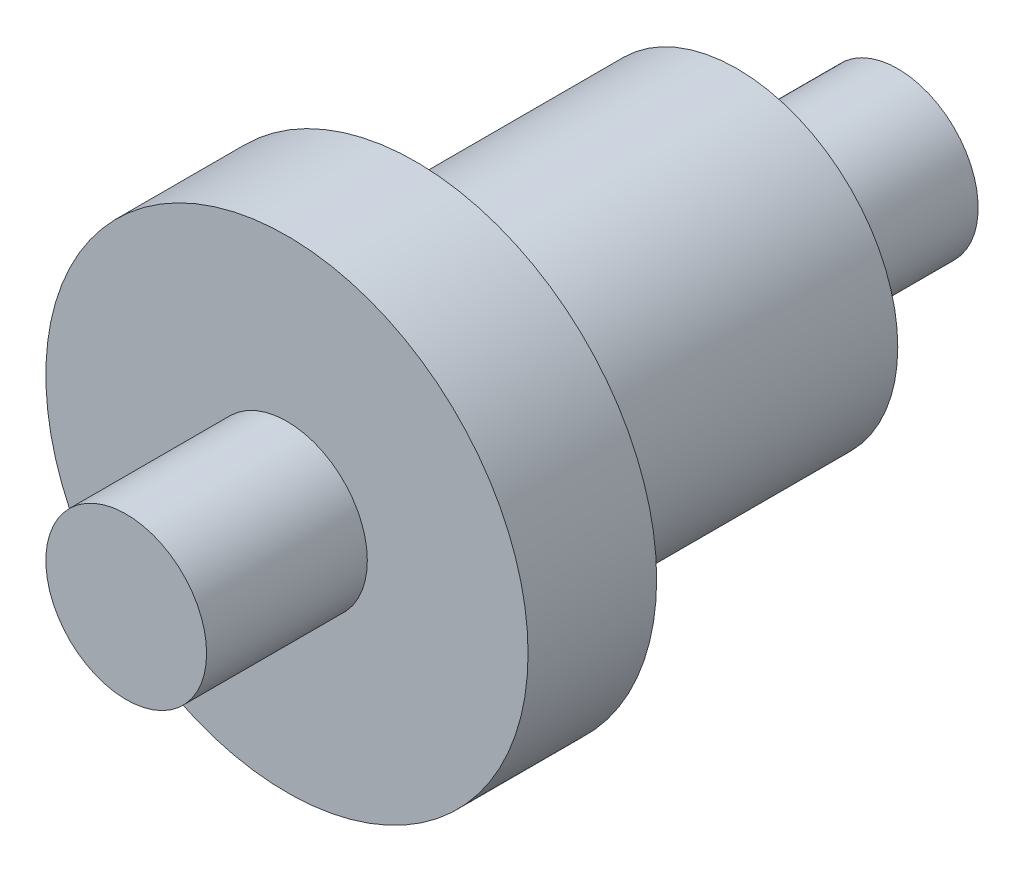
from build123d import *

# Parameters (mm, degrees)
SKETCH1_R           = 9.525
BOSS_EXTRUDE1_DEPTH = 5.08
SKETCH2_R           = 6.35
BOSS_EXTRUDE2_DEPTH = 12.7
SKETCH3_R           = 3.175
BOSS_EXTRUDE3_DEPTH = 6.35
BOSS_EXTRUDE4_START = 6.35
SKETCH4_R           = 3.175
BOSS_EXTRUDE4_DEPTH = 6.35


with BuildPart() as part:
    # Sketch1 → Boss-Extrude1 (new body)
    with BuildSketch(Plane.XY):
        Circle(SKETCH1_R)
    extrude(amount=BOSS_EXTRUDE1_DEPTH)

    # Sketch2 → Boss-Extrude2 (add)
    with BuildSketch(Plane(origin=(0, 0, 0), x_dir=(-1, 0, 0), z_dir=(0, 0, -1))):
        with Locations(Location((0, 0, 0), (0, 0, 180))):
            Circle(SKETCH2_R)
    extrude(amount=BOSS_EXTRUDE2_DEPTH)

    # Sketch3 → Boss-Extrude3 (add)
    with BuildSketch(Plane(origin=(0, 0, -12.7), x_dir=(-1, 0, 0), z_dir=(0, 0, -1))):
        Circle(SKETCH3_R)
    extrude(amount=BOSS_EXTRUDE3_DEPTH)

    # Sketch4 → Boss-Extrude4 (add)
    with BuildSketch(Plane.XY.offset(5.08).offset(BOSS_EXTRUDE4_START)):
        with Locations(Location((0, 0, 0), (0, 0, 180))):
            Circle(SKETCH4_R)
    extrude(amount=-BOSS_EXTRUDE4_DEPTH)


solid = part.part
